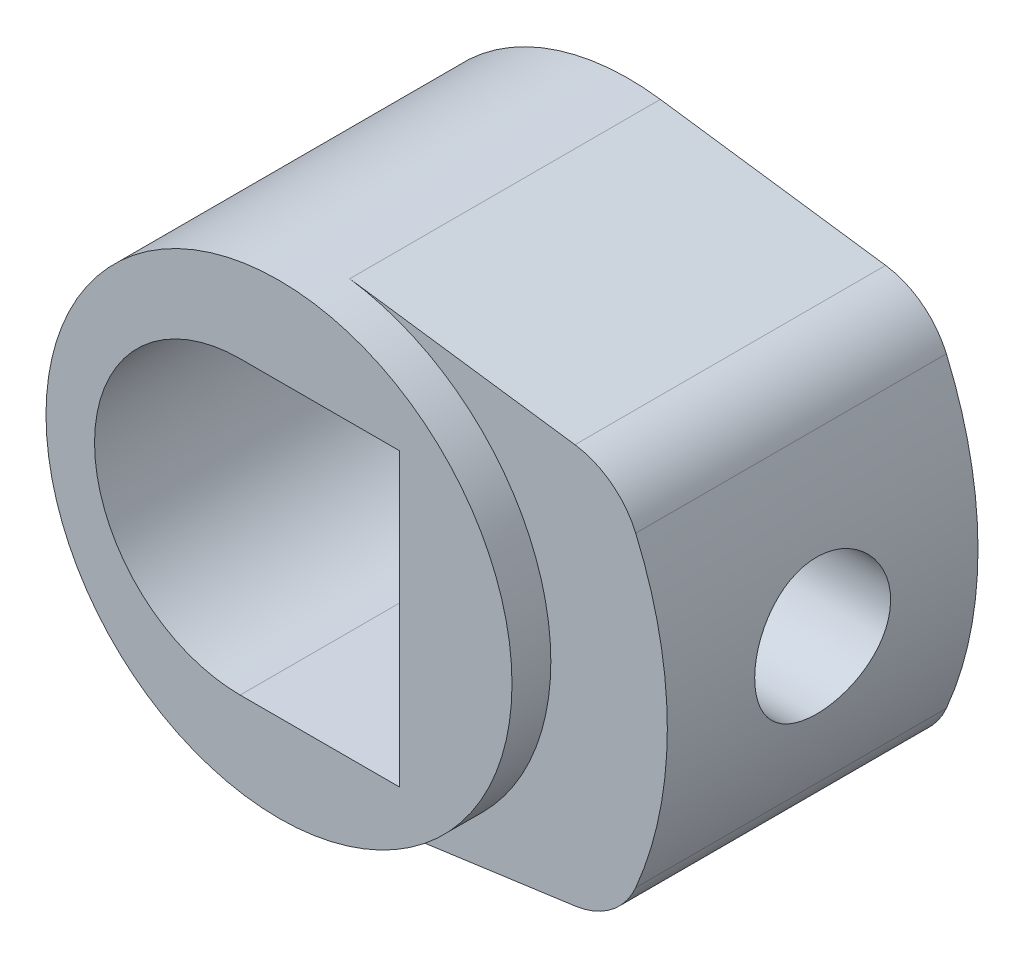
from build123d import *

# Parameters (mm, degrees)
BOSS_EXTRUDE1_DEPTH = 8
BOSS_EXTRUDE2_START = 1
SKETCH2_R           = 6
BOSS_EXTRUDE2_DEPTH = 1
CUT_EXTRUDE1_DEPTH  = 15.730919863
CUT_EXTRUDE2_DEPTH  = 2.9
HOLEWZD1_D          = 3.5
HOLEWZD1_DEPTH      = 3
FILLET1_R           = 0.6
FILLET2_R           = 2


with BuildPart() as part:
    # Sketch1 → Boss-Extrude1 (new body)
    with BuildSketch(Plane.XY.offset(-1)):
        with BuildLine():
            Line((8.660254038, 5), (1.820011325, 5.943700987))
            ThreePointArc((1.820011325, 5.943700987), (-5, 0), (1.820011325, -5.943700987))
            Line((1.820011325, -5.943700987), (8.660254038, -5))
            ThreePointArc((8.660254038, -5), (10, 0), (8.660254038, 5))
        make_face()
    extrude(amount=-BOSS_EXTRUDE1_DEPTH)

    # Sketch2 → Boss-Extrude2 (add)
    with BuildSketch(Plane.XY.offset(-1).offset(BOSS_EXTRUDE2_START)):
        with Locations((1, 0)):
            Circle(SKETCH2_R)
    extrude(amount=-BOSS_EXTRUDE2_DEPTH)

    # Sketch3 → Cut-Extrude1 (cut, through all)
    with BuildSketch(Plane.XY):
        with BuildLine():
            Line((0, -3.75), (4.1, -3.75))
            Line((4.1, -3.75), (4.1, 3.75))
            Line((4.1, 3.75), (0, 3.75))
            ThreePointArc((0, 3.75), (-3.75, 0), (0, -3.75))
        make_face()
    extrude(amount=-CUT_EXTRUDE1_DEPTH, mode=Mode.SUBTRACT)

    # Sketch4 → Cut-Extrude2 (cut)
    with BuildSketch(Plane.ZY.offset(-4.1)):
        Polygon((-9, -3), (-3.267949192, -3), (-1.535898385, 0), (-3.267949192, 3), (-9, 3), align=None)
    extrude(amount=-CUT_EXTRUDE2_DEPTH, mode=Mode.SUBTRACT)

    # HoleWzd1
    with Locations(Plane.ZY.offset(-7)):
        with Locations((-5, 0)):
            Hole(HOLEWZD1_D / 2, depth=HOLEWZD1_DEPTH)

    # Fillet1
    fillet1_edges = [part.edges().sort_by_distance(p)[0] for p in [
        (4.1, -3, -6.133974596),
        (4.1, 3, -6.133974596),
    ]]
    fillet(fillet1_edges, radius=FILLET1_R)

    # Fillet2
    fillet2_edges = [part.edges().sort_by_distance(p)[0] for p in [
        (8.660254038, -5, -5),
        (8.660254038, 5, -5),
    ]]
    fillet(fillet2_edges, radius=FILLET2_R)


solid = part.part
